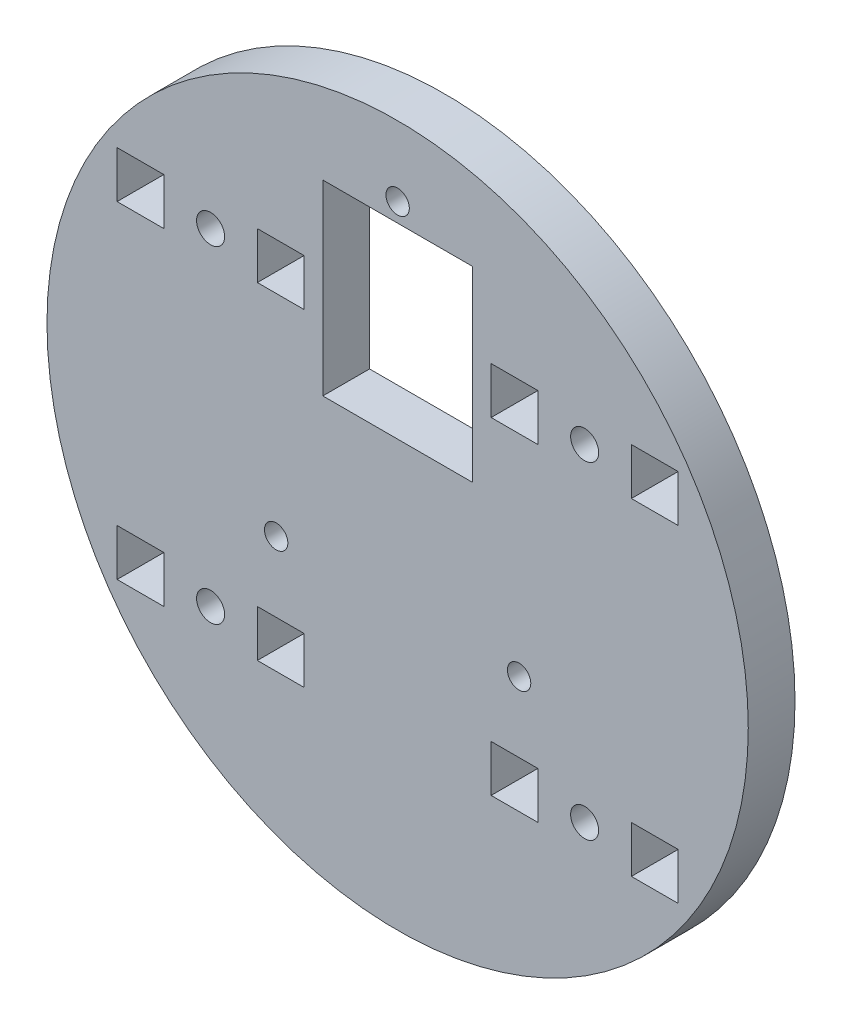
from build123d import *

# Parameters (mm, degrees)
SKETCH1_R           = 37.5
BOSS_EXTRUDE1_DEPTH = 5
SKETCH9_R           = 1.25
SKETCH9_R_2         = 1.5
SKETCH9_W           = 16
SKETCH9_H           = 20
SKETCH9_W_2         = 5
SKETCH9_H_2         = 5
CUT_EXTRUDE5_DEPTH  = 54.268189382


with BuildPart() as part:
    # Sketch1 → Boss-Extrude1 (new body)
    with BuildSketch(Plane.XY):
        Circle(SKETCH1_R)
    extrude(amount=BOSS_EXTRUDE1_DEPTH)

    # Sketch9 → Cut-Extrude5 (cut, through all)
    with BuildSketch(Plane.XY.offset(5)):
        with Locations((0, 30)):
            Circle(SKETCH9_R)
        with Locations((12.990381057, -7.5)):
            Circle(SKETCH9_R)
        with Locations((-12.990381057, -7.5)):
            Circle(SKETCH9_R)
        with Locations((20, 17.5)):
            Circle(SKETCH9_R_2)
        with Locations((-20, 17.5)):
            Circle(SKETCH9_R_2)
        with Locations(Location((20, -17.5, 0), (0, 0, 90))):
            Circle(SKETCH9_R_2)
        with Locations(Location((-20, -17.5, 0), (0, 0, 90))):
            Circle(SKETCH9_R_2)
        with Locations((0, 18)):
            Rectangle(SKETCH9_W, SKETCH9_H)
        with Locations((12.5, 17.5)):
            Rectangle(SKETCH9_W_2, SKETCH9_H_2)
        with Locations((27.5, 17.5)):
            Rectangle(SKETCH9_W_2, SKETCH9_H_2)
        with Locations((-27.5, 17.5)):
            Rectangle(SKETCH9_W_2, SKETCH9_H_2)
        with Locations((-12.5, 17.5)):
            Rectangle(SKETCH9_W_2, SKETCH9_H_2)
        with Locations((12.5, -17.5)):
            Rectangle(SKETCH9_W_2, SKETCH9_H_2)
        with Locations((27.5, -17.5)):
            Rectangle(SKETCH9_W_2, SKETCH9_H_2)
        with Locations((-27.5, -17.5)):
            Rectangle(SKETCH9_W_2, SKETCH9_H_2)
        with Locations((-12.5, -17.5)):
            Rectangle(SKETCH9_W_2, SKETCH9_H_2)
    extrude(amount=-CUT_EXTRUDE5_DEPTH, mode=Mode.SUBTRACT)


solid = part.part
